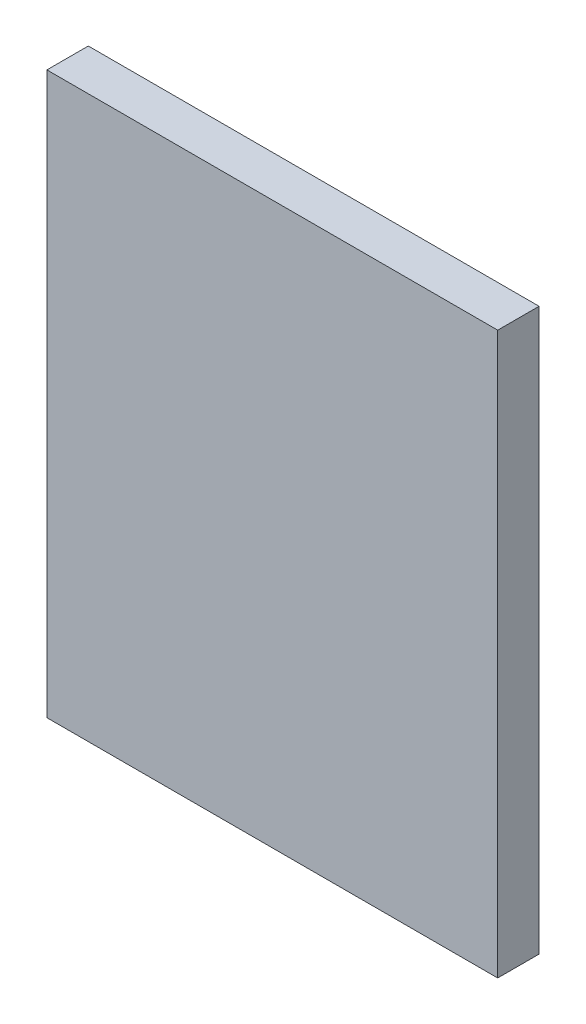
from build123d import *

# Parameters (mm, degrees)
SKIZZE1_W                       = 17.432
SKIZZE1_H                       = 21.696
AUFSATZ_LINEAR_AUSTRAGEN1_DEPTH = 1.6


with BuildPart() as part:
    # Skizze1 → Aufsatz-Linear austragen1 (new body)
    with BuildSketch(Plane.XY):
        with Locations((-11.691662771, 2.372475859)):
            Rectangle(SKIZZE1_W, SKIZZE1_H)
    extrude(amount=AUFSATZ_LINEAR_AUSTRAGEN1_DEPTH)


solid = part.part
